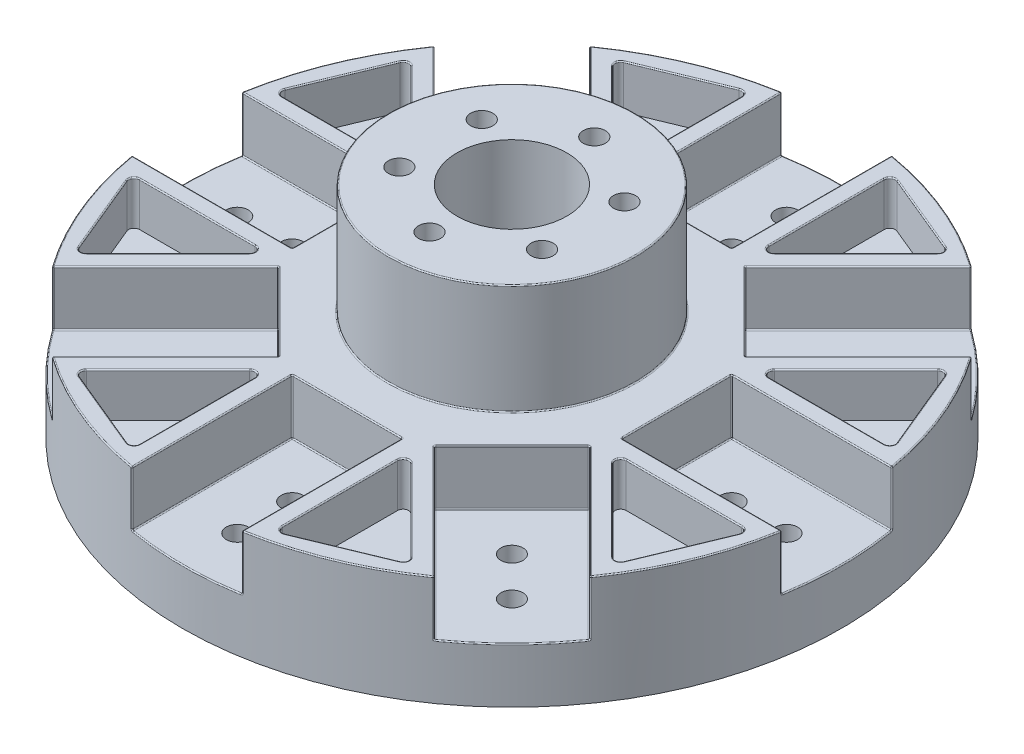
from build123d import *

# Parameters (mm, degrees)
SKETCH2_R           = 76.2
BOSS_EXTRUDE1_DEPTH = 25.4
SKETCH4_R           = 28.575
BOSS_EXTRUDE2_DEPTH = 25.4
SKETCH3_W           = 25.4
SKETCH3_H           = 76.2
CUT_EXTRUDE1_DEPTH  = 12.7
CIRPATTERN1_COUNT   = 8
SKETCH5_R           = 12.7
CUT_EXTRUDE2_DEPTH  = 120.1365603
CUT_EXTRUDE3_DEPTH  = 10.16
CIRPATTERN2_COUNT   = 8
CIRPATTERN3_COUNT   = 6
SKETCH11_R          = 2.54
CUT_EXTRUDE5_DEPTH  = 115.3
CIRPATTERN4_COUNT   = 8
FILLET1_R           = 0.254


with BuildPart() as part:
    # Sketch2 → Boss-Extrude1 (new body)
    with BuildSketch(Plane(origin=(0, 0, 0), x_dir=(1, 0, 0), z_dir=(0, 1, 0))):
        with Locations(Location((0, 0, 0), (0, 0, 270))):
            Circle(SKETCH2_R)
    extrude(amount=BOSS_EXTRUDE1_DEPTH)

    # Sketch4 → Boss-Extrude2 (add)
    with BuildSketch(Plane(origin=(0, 25.4, 0), x_dir=(1, 0, 0), z_dir=(0, 1, 0))):
        with Locations(Location((0, 0, 0), (0, 0, 270))):
            Circle(SKETCH4_R)
    extrude(amount=BOSS_EXTRUDE2_DEPTH)

    # Sketch3 → Cut-Extrude1 (cut)
    with BuildSketch(Plane(origin=(0, 25.4, 0), x_dir=(1, 0, 0), z_dir=(0, 1, 0))):
        with Locations((0, -76.2)):
            Rectangle(SKETCH3_W, SKETCH3_H)
    cut_extrude1 = extrude(amount=-CUT_EXTRUDE1_DEPTH, mode=Mode.SUBTRACT)

    # CirPattern1: Cut-Extrude1 ×8 about axis
    cirpattern1_axis = Axis((0, 0, 0), (0, 1, 0))
    for i in range(1, CIRPATTERN1_COUNT):
        add(cut_extrude1.rotate(cirpattern1_axis, i * 360 / CIRPATTERN1_COUNT), mode=Mode.SUBTRACT)

    # Sketch5 → Cut-Extrude2 (cut, through all)
    with BuildSketch(Plane(origin=(0, 50.8, 0), x_dir=(1, 0, 0), z_dir=(0, 1, 0))):
        with Locations(Location((0, 0, 0), (0, 0, 270))):
            Circle(SKETCH5_R)
    extrude(amount=-CUT_EXTRUDE2_DEPTH, mode=Mode.SUBTRACT)

    # Sketch7 → Cut-Extrude3 (cut)
    with BuildSketch(Plane(origin=(0, 25.4, 0), x_dir=(1, 0, 0), z_dir=(0, 1, 0))):
        with BuildLine():
            Line((-18.678025612, -42.026691527), (-37.522375813, -60.871041727))
            ThreePointArc((-37.522375813, -60.871041727), (-37.869947507, -62.016832049), (-37.11035816, -62.942394346))
            Line((-37.11035816, -62.942394346), (-18.266007959, -70.747979773))
            ThreePointArc((-18.266007959, -70.747979773), (-17.074425804, -70.630619174), (-16.51, -69.574652767))
            Line((-16.51, -69.574652767), (-16.51, -42.924717139))
            ThreePointArc((-16.51, -42.924717139), (-17.293992041, -41.751390133), (-18.678025612, -42.026691527))
        make_face()
    cut_extrude3 = extrude(amount=-CUT_EXTRUDE3_DEPTH, mode=Mode.SUBTRACT)

    # CirPattern2: Cut-Extrude3 ×8 about axis
    cirpattern2_axis = Axis((0, 0, 0), (0, 1, 0))
    for i in range(1, CIRPATTERN2_COUNT):
        add(cut_extrude3.rotate(cirpattern2_axis, i * 360 / CIRPATTERN2_COUNT), mode=Mode.SUBTRACT)

    # Sketch10 → Tap Drill for 1/4-20 Tap1 (revolve, cut)
    with BuildSketch(Plane(origin=(0, 50.8, -19.05), x_dir=(0, 0, 1), z_dir=(1, 0, 0))):
        Polygon((0, 0), (0, 14.233816902), (2.5527, 12.7), (2.5527, 0), align=None)
    tap_drill_for_1_4_20_tap1 = revolve(axis=Axis((0, 57.15, -19.05), (0, -1, 0)), mode=Mode.SUBTRACT)

    # CirPattern3: Tap Drill for 1/4-20 Tap1 ×6 about axis
    cirpattern3_axis = Axis((0, 0, 0), (0, 1, 0))
    for i in range(1, CIRPATTERN3_COUNT):
        add(tap_drill_for_1_4_20_tap1.rotate(cirpattern3_axis, i * 360 / CIRPATTERN3_COUNT), mode=Mode.SUBTRACT)

    # Sketch11 → Cut-Extrude5 (cut, through all)
    with BuildSketch(Plane(origin=(0, 12.7, 0), x_dir=(1, 0, 0), z_dir=(0, 1, 0))):
        with Locations(Location((0, -50.8, 0), (0, 0, 270))):
            Circle(SKETCH11_R)
        with Locations(Location((0, -63.5, 0), (0, 0, 270))):
            Circle(SKETCH11_R)
    cut_extrude5 = extrude(amount=-CUT_EXTRUDE5_DEPTH, mode=Mode.SUBTRACT)

    # CirPattern4: Cut-Extrude5 ×8 about axis
    cirpattern4_axis = Axis((0, 0, 0), (0, 1, 0))
    for i in range(1, CIRPATTERN4_COUNT):
        add(cut_extrude5.rotate(cirpattern4_axis, i * 360 / CIRPATTERN4_COUNT), mode=Mode.SUBTRACT)

    # Fillet1
    fillet1_edges = [part.edges().sort_by_distance(p)[0] for p in [
        (26.940768363, 25.4, 26.940768363),
        (62.108167806, 19.05, 44.147655564),
        (49.014596145, 12.7, 31.054083903),
        (35.921024484, 19.05, 17.960512242),
        (31.054083903, 12.7, 49.014596145),
        (44.147655564, 19.05, 62.108167806),
        (26.940768363, 12.7, 26.940768363),
        (17.960512242, 19.05, 35.921024484),
        (-49.014596145, 25.4, 31.054083903),
        (-26.940768363, 25.4, 26.940768363),
        (-44.147655564, 19.05, 62.108167806),
        (-31.054083903, 12.7, 49.014596145),
        (-17.960512242, 19.05, 35.921024484),
        (-49.014596145, 12.7, 31.054083903),
        (-62.108167806, 19.05, 44.147655564),
        (-26.940768363, 12.7, 26.940768363),
        (-35.921024484, 19.05, 17.960512242),
        (12.7, 25.4, 56.617106623),
        (6.372321033, 12.7, 75.933085836),
        (-12.7, 25.4, 56.617106623),
        (0, 25.4, 38.1),
        (12.7, 19.05, 75.134213245),
        (12.7, 12.7, 56.617106623),
        (12.7, 19.05, 38.1),
        (-12.7, 12.7, 56.617106623),
        (-12.7, 19.05, 75.134213245),
        (-37.869947507, 25.4, 62.016832049),
        (-27.688183059, 25.4, 66.845187059),
        (-17.074425804, 25.4, 70.630619174),
        (-16.51, 25.4, 56.249684953),
        (-17.293992041, 25.4, 41.751390133),
        (0, 12.7, 38.1),
        (-28.100200712, 25.4, 51.448866627),
        (-12.7, 19.05, 38.1),
        (17.074425804, 25.4, 70.630619174),
        (27.688183059, 25.4, 66.845187059),
        (37.869947507, 25.4, 62.016832049),
        (28.100200712, 25.4, 51.448866627),
        (17.293992041, 25.4, 41.751390133),
        (16.51, 25.4, 56.249684953),
        (62.016832049, 25.4, 37.869947507),
        (66.845187059, 25.4, 27.688183059),
        (70.630619174, 25.4, 17.074425804),
        (56.249684953, 25.4, 16.51),
        (41.751390133, 25.4, 17.293992041),
        (51.448866627, 25.4, 28.100200712),
        (70.630619174, 25.4, -17.074425804),
        (66.845187059, 25.4, -27.688183059),
        (62.016832049, 25.4, -37.869947507),
        (51.448866627, 25.4, -28.100200712),
        (41.751390133, 25.4, -17.293992041),
        (56.249684953, 25.4, -16.51),
        (37.869947507, 25.4, -62.016832049),
        (27.688183059, 25.4, -66.845187059),
        (17.074425804, 25.4, -70.630619174),
        (16.51, 25.4, -56.249684953),
        (17.293992041, 25.4, -41.751390133),
        (28.100200712, 25.4, -51.448866627),
        (-17.074425804, 25.4, -70.630619174),
        (-27.688183059, 25.4, -66.845187059),
        (-37.869947507, 25.4, -62.016832049),
        (-28.100200712, 25.4, -51.448866627),
        (-17.293992041, 25.4, -41.751390133),
        (-16.51, 25.4, -56.249684953),
        (-62.016832049, 25.4, -37.869947507),
        (-66.845187059, 25.4, -27.688183059),
        (-70.630619174, 25.4, -17.074425804),
        (-56.249684953, 25.4, -16.51),
        (-41.751390133, 25.4, -17.293992041),
        (-51.448866627, 25.4, -28.100200712),
        (-70.630619174, 25.4, 17.074425804),
        (-66.845187059, 25.4, 27.688183059),
        (-62.016832049, 25.4, 37.869947507),
        (-51.448866627, 25.4, 28.100200712),
        (-41.751390133, 25.4, 17.293992041),
        (-56.249684953, 25.4, 16.51),
        (70.399620377, 25.4, 29.160477546),
        (70.399620377, 25.4, -29.160477546),
        (29.160477546, 25.4, -70.399620377),
        (-29.160477546, 25.4, -70.399620377),
        (-70.399620377, 25.4, -29.160477546),
        (-70.399620377, 25.4, 29.160477546),
        (-29.160477546, 25.4, 70.399620377),
        (-31.054083903, 25.4, 49.014596145),
        (49.014596145, 25.4, 31.054083903),
        (56.617106623, 25.4, -12.7),
        (31.054083903, 25.4, -49.014596145),
        (-12.7, 25.4, -56.617106623),
        (-49.014596145, 25.4, -31.054083903),
        (-56.617106623, 25.4, 12.7),
        (-53.881536726, 12.7, 53.881536726),
        (53.881536726, 12.7, 53.881536726),
        (76.2, 12.7, 0),
        (53.881536726, 12.7, -53.881536726),
        (0, 12.7, -76.2),
        (29.160477546, 25.4, 70.399620377),
        (-53.881536726, 12.7, -53.881536726),
        (-76.2, 12.7, 0),
        (-56.617106623, 25.4, -12.7),
        (-38.1, 25.4, 0),
        (-75.134213245, 19.05, 12.7),
        (-56.617106623, 12.7, 12.7),
        (-38.1, 19.05, 12.7),
        (-56.617106623, 12.7, -12.7),
        (-75.134213245, 19.05, -12.7),
        (-38.1, 12.7, 0),
        (-38.1, 19.05, -12.7),
        (0, 25.4, -28.575),
        (-31.054083903, 25.4, -49.014596145),
        (-26.940768363, 25.4, -26.940768363),
        (-62.108167806, 19.05, -44.147655564),
        (-49.014596145, 12.7, -31.054083903),
        (-35.921024484, 19.05, -17.960512242),
        (-31.054083903, 12.7, -49.014596145),
        (-44.147655564, 19.05, -62.108167806),
        (-26.940768363, 12.7, -26.940768363),
        (-17.960512242, 19.05, -35.921024484),
        (0, 50.8, -28.575),
        (12.7, 25.4, -56.617106623),
        (0, 25.4, -38.1),
        (-12.7, 19.05, -75.134213245),
        (-12.7, 12.7, -56.617106623),
        (-12.7, 19.05, -38.1),
        (12.7, 12.7, -56.617106623),
        (12.7, 19.05, -75.134213245),
        (0, 12.7, -38.1),
        (12.7, 19.05, -38.1),
        (49.014596145, 25.4, -31.054083903),
        (26.940768363, 25.4, -26.940768363),
        (44.147655564, 19.05, -62.108167806),
        (31.054083903, 12.7, -49.014596145),
        (17.960512242, 19.05, -35.921024484),
        (49.014596145, 12.7, -31.054083903),
        (62.108167806, 19.05, -44.147655564),
        (26.940768363, 12.7, -26.940768363),
        (35.921024484, 19.05, -17.960512242),
        (56.617106623, 25.4, 12.7),
        (38.1, 25.4, 0),
        (75.134213245, 19.05, -12.7),
        (56.617106623, 12.7, -12.7),
        (38.1, 19.05, -12.7),
        (56.617106623, 12.7, 12.7),
        (75.134213245, 19.05, 12.7),
        (38.1, 12.7, 0),
        (38.1, 19.05, 12.7),
        (31.054083903, 25.4, 49.014596145),
    ]]
    fillet(fillet1_edges, radius=FILLET1_R)


solid = part.part
